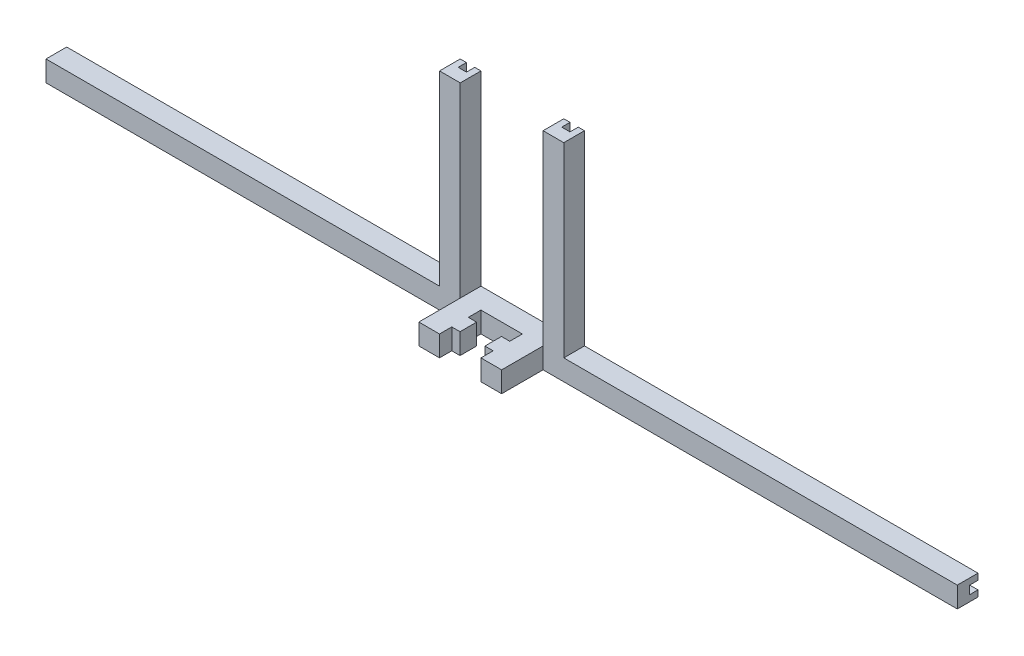
from build123d import *

# Parameters (mm, degrees)
SKETCH1_W           = 20
SKETCH1_H           = 40
BOSS_EXTRUDE1_DEPTH = 50
SKETCH2_W           = 50
SKETCH2_H           = 50
BOSS_EXTRUDE2_DEPTH = 1000
SKETCH3_W           = 50
SKETCH3_H           = 50
BOSS_EXTRUDE3_DEPTH = 1000
SKETCH4_W           = 50
SKETCH4_H           = 50
BOSS_EXTRUDE4_DEPTH = 450
SKETCH6_W           = 650
SKETCH6_H           = 20
CUT_EXTRUDE2_DEPTH  = 20
SKETCH7_W           = 20
SKETCH7_H           = 450
CUT_EXTRUDE3_DEPTH  = 20


with BuildPart() as part:
    # Sketch1 → Boss-Extrude1 (new body)
    with BuildSketch(Plane(origin=(0, 0, 0), x_dir=(1, 0, 0), z_dir=(0, 1, 0))):
        Polygon((-31.607653806, 251.508316195), (0, 251.508316195), (68.392346194, 251.508316195), (68.392346194, 221.086115448), (68.392346194, 181.086115448), (68.392346194, 151.508316195), (118.392346194, 151.508316195), (118.392346194, 301.508316195), (-81.607653806, 301.508316195), (-81.607653806, 151.508316195), (-31.607653806, 151.508316195), (-31.607653806, 181.086115448), (-31.607653806, 221.086115448), align=None)
        with Locations((-21.607653806, 201.086115448)):
            Rectangle(SKETCH1_W, SKETCH1_H)
        with Locations((58.392346194, 201.086115448)):
            Rectangle(SKETCH1_W, SKETCH1_H)
    extrude(amount=BOSS_EXTRUDE1_DEPTH)

    # Sketch2 → Boss-Extrude2 (add)
    with BuildSketch(Plane(origin=(118.392346194, 0, 0), x_dir=(0, 0, -1), z_dir=(1, 0, 0))):
        with Locations((276.508316195, 25)):
            Rectangle(SKETCH2_W, SKETCH2_H)
    extrude(amount=BOSS_EXTRUDE2_DEPTH)

    # Sketch3 → Boss-Extrude3 (add)
    with BuildSketch(Plane.ZY.offset(81.607653806)):
        with Locations((-276.508316195, 25)):
            Rectangle(SKETCH3_W, SKETCH3_H)
    extrude(amount=BOSS_EXTRUDE3_DEPTH)

    # Sketch4 → Boss-Extrude4 (add)
    with BuildSketch(Plane(origin=(0, 50, 0), x_dir=(1, 0, 0), z_dir=(0, 1, 0))):
        with Locations((-106.607653806, 276.508316195)):
            Rectangle(SKETCH4_W, SKETCH4_H)
        with Locations((143.392346194, 276.508316195)):
            Rectangle(SKETCH4_W, SKETCH4_H)
    extrude(amount=BOSS_EXTRUDE4_DEPTH)

    # Sketch6 → Cut-Extrude2 (cut)
    with BuildSketch(Plane(origin=(0, 0, -301.508316195), x_dir=(-1, 0, 0), z_dir=(0, 0, -1))):
        with Locations((756.607653806, 25)):
            Rectangle(SKETCH6_W, SKETCH6_H)
        with Locations((-793.392346194, 25)):
            Rectangle(SKETCH6_W, SKETCH6_H)
    extrude(amount=-CUT_EXTRUDE2_DEPTH, mode=Mode.SUBTRACT)

    # Sketch7 → Cut-Extrude3 (cut)
    with BuildSketch(Plane(origin=(0, 0, -301.508316195), x_dir=(-1, 0, 0), z_dir=(0, 0, -1))):
        with Locations((-143.392346194, 275)):
            Rectangle(SKETCH7_W, SKETCH7_H)
        with Locations((106.607653806, 275)):
            Rectangle(SKETCH7_W, SKETCH7_H)
    extrude(amount=-CUT_EXTRUDE3_DEPTH, mode=Mode.SUBTRACT)


solid = part.part
